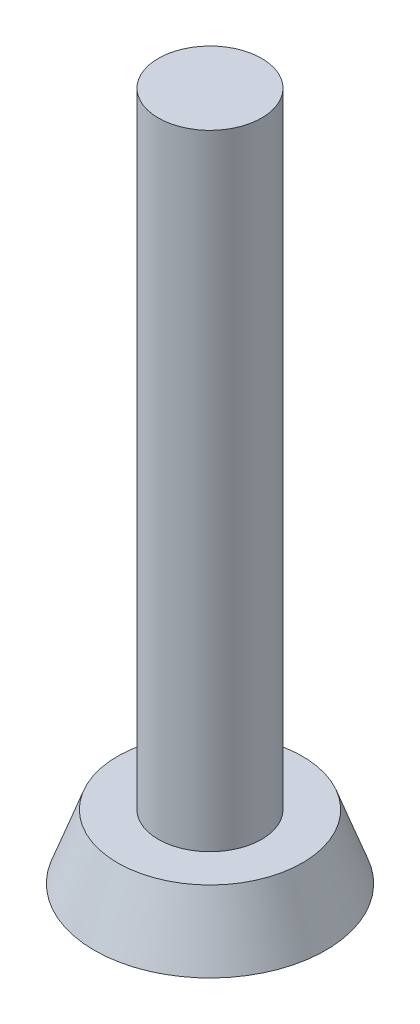
from build123d import *

# Parameters (mm, degrees)
SKETCH1_R           = 3.36
BOSS_EXTRUDE1_DEPTH = 1.86
BOSS_EXTRUDE1_TAPER = 20
SKETCH2_R           = 1.5
BOSS_EXTRUDE2_DEPTH = 18.14
CUT_EXTRUDE1_DEPTH  = 1.5


with BuildPart() as part:
    # Sketch1 → Boss-Extrude1 (new body)
    with BuildSketch(Plane(origin=(0, 0, 0), x_dir=(1, 0, 0), z_dir=(0, 1, 0))):
        Circle(SKETCH1_R)
    extrude(amount=BOSS_EXTRUDE1_DEPTH, taper=BOSS_EXTRUDE1_TAPER)

    # Sketch2 → Boss-Extrude2 (add)
    with BuildSketch(Plane(origin=(0, 1.86, 0), x_dir=(1, 0, 0), z_dir=(0, 1, 0))):
        with Locations(Location((0, 0, 0), (0, 0, 270))):
            Circle(SKETCH2_R)
    extrude(amount=BOSS_EXTRUDE2_DEPTH)

    # Sketch3 → Cut-Extrude1 (cut)
    with BuildSketch(Plane.XZ):
        Polygon((0, 1.154700538), (-1, 0.577350269), (-1, -0.577350269), (0, -1.154700538), (1, -0.577350269), (1, 0.577350269), align=None)
    extrude(amount=-CUT_EXTRUDE1_DEPTH, mode=Mode.SUBTRACT)


solid = part.part
